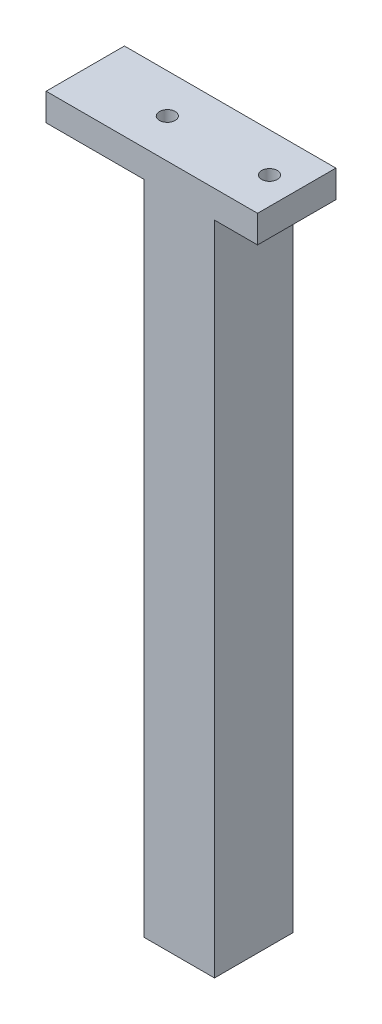
from build123d import *

# Parameters (mm, degrees)
SKETCH1_W           = 40
SKETCH1_H           = 20
BOSS_EXTRUDE1_DEPTH = 7
SKETCH2_R           = 2
CUT_EXTRUDE1_DEPTH  = 25.19584861
SKETCH3_W           = 18
SKETCH3_H           = 20
BOSS_EXTRUDE2_DEPTH = 167.64
SKETCH4_W           = 10
SKETCH4_H           = 12
CUT_EXTRUDE2_DEPTH  = 167.64
SKETCH7_W           = 20
SKETCH7_H           = 7
BOSS_EXTRUDE3_DEPTH = 14


with BuildPart() as part:
    # Sketch1 → Boss-Extrude1 (new body)
    with BuildSketch(Plane(origin=(0, 0, 0), x_dir=(1, 0, 0), z_dir=(0, 1, 0))):
        with Locations((0.745622296, 0.298458403)):
            Rectangle(SKETCH1_W, SKETCH1_H)
    extrude(amount=BOSS_EXTRUDE1_DEPTH)

    # Sketch2 → Cut-Extrude1 (cut, through all)
    with BuildSketch(Plane(origin=(0, 7, 0), x_dir=(1, 0, 0), z_dir=(0, 1, 0))):
        with Locations(Location((-12.304377704, 0.298458403, 0), (0, 0, 270))):
            Circle(SKETCH2_R)
        with Locations(Location((13.795622296, 0.298458403, 0), (0, 0, 270))):
            Circle(SKETCH2_R)
    extrude(amount=-CUT_EXTRUDE1_DEPTH, mode=Mode.SUBTRACT)

    # Sketch3 → Boss-Extrude2 (add)
    with BuildSketch(Plane(origin=(0, 0, 0), x_dir=(-1, 0, 0), z_dir=(0, -1, 0))):
        with Locations((-0.745622296, 0.298458403)):
            Rectangle(SKETCH3_W, SKETCH3_H)
    extrude(amount=BOSS_EXTRUDE2_DEPTH)

    # Sketch4 → Cut-Extrude2 (cut)
    with BuildSketch(Plane.XZ.offset(167.64)):
        with Locations((0.745622296, -0.298458403)):
            Rectangle(SKETCH4_W, SKETCH4_H)
    extrude(amount=-CUT_EXTRUDE2_DEPTH, mode=Mode.SUBTRACT)

    # Sketch7 → Boss-Extrude3 (add)
    with BuildSketch(Plane.ZY.offset(19.254377704)):
        with Locations((-0.298458403, 3.5)):
            Rectangle(SKETCH7_W, SKETCH7_H)
    extrude(amount=BOSS_EXTRUDE3_DEPTH)


solid = part.part
